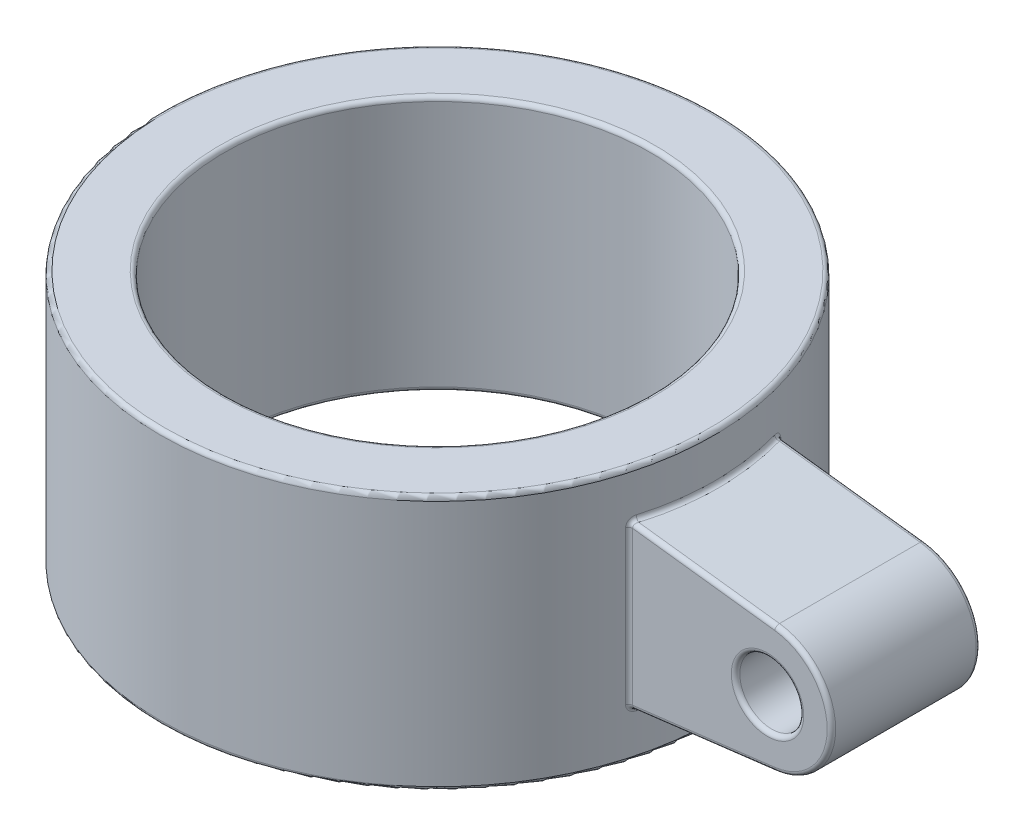
from build123d import *

# Parameters (mm, degrees)
SKETCH1_R           = 6.5
SKETCH1_R_2         = 5
BOSS_EXTRUDE1_DEPTH = 3
SKETCH2_R           = 0.75
BOSS_EXTRUDE2_DEPTH = 1.75
FILLET1_R           = 0.1


with BuildPart() as part:
    # Sketch1 → Boss-Extrude1 (new, symmetric)
    with BuildSketch(Plane(origin=(0, 0, 0), x_dir=(1, 0, 0), z_dir=(0, 1, 0))):
        with Locations(Location((0, 0, 0), (0, 0, 270))):
            Circle(SKETCH1_R)
        with Locations(Location((0, 0, 0), (0, 0, 270))):
            Circle(SKETCH1_R_2, mode=Mode.SUBTRACT)
    extrude(amount=BOSS_EXTRUDE1_DEPTH, both=True)

    # Sketch2 → Boss-Extrude2 (add, symmetric)
    with BuildSketch(Plane.XY):
        with BuildLine():
            Line((5.5, 2), (5.5, -2))
            Line((5.5, -2), (9.681961233, -1.488922466))
            ThreePointArc((9.681961233, -1.488922466), (11, 0), (9.681961233, 1.488922466))
            Line((9.681961233, 1.488922466), (5.5, 2))
        make_face()
        with Locations((9.5, 0)):
            Circle(SKETCH2_R, mode=Mode.SUBTRACT)
    extrude(amount=BOSS_EXTRUDE2_DEPTH, both=True)

    # Fillet1
    fillet1_edges = [part.edges().sort_by_distance(p)[0] for p in [
        (6.5, -1.877789988, 0),
        (6.259992013, 0, -1.75),
        (6.259992013, 0, 1.75),
        (6.5, 1.877789988, 0),
        (7.970976623, -1.698021916, 1.75),
        (11, 0, 1.75),
        (7.970976623, 1.698021916, 1.75),
        (8.75, 0, -1.75),
        (7.970976623, 1.698021916, -1.75),
        (7.970976623, -1.698021916, -1.75),
        (11, 0, -1.75),
        (8.75, 0, 1.75),
        (0, -3, -6.5),
        (0, 3, -6.5),
        (0, -3, -5),
        (0, 3, -5),
    ]]
    fillet(fillet1_edges, radius=FILLET1_R)


solid = part.part
